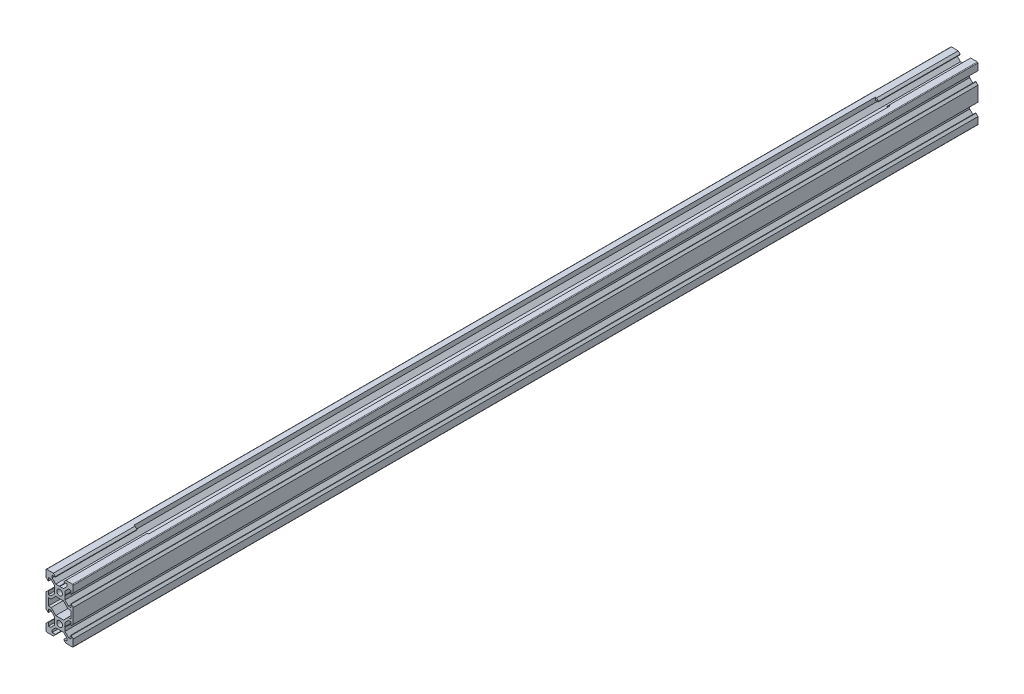
from build123d import *

# Parameters (mm, degrees)
SKETCH1_R           = 2.1
BOSS_EXTRUDE1_DEPTH = 332.5
SKETCH2_W           = 11
SKETCH2_H           = 1.8
CUT_EXTRUDE1_DEPTH  = 272.5


with BuildPart() as part:
    # Sketch1 → Boss-Extrude1 (new, symmetric)
    with BuildSketch(Plane.XY):
        with BuildLine():
            Line((4.58, -20), (9.5, -20))
            ThreePointArc((9.5, -20), (9.853553391, -19.853553391), (10, -19.5))
            Line((10, -19.5), (10, -14.58))
            Line((10, -14.58), (8.545, -13.125))
            Line((8.545, -13.125), (8.2, -13.125))
            Line((8.2, -13.125), (8.2, -15.5))
            Line((8.2, -15.5), (6.560660172, -15.5))
            Line((6.560660172, -15.5), (3.9, -12.839339828))
            Line((3.9, -12.839339828), (3.9, -10.21))
            Line((3.9, -10.21), (3.69, -10))
            Line((3.69, -10), (3.9, -9.79))
            Line((3.9, -9.79), (3.9, -7.160660172))
            Line((3.9, -7.160660172), (6.560660172, -4.5))
            Line((6.560660172, -4.5), (8.2, -4.5))
            Line((8.2, -4.5), (8.2, -6.875))
            Line((8.2, -6.875), (8.545, -6.875))
            Line((8.545, -6.875), (10, -5.42))
            Line((10, -5.42), (10, 5.42))
            Line((10, 5.42), (8.545, 6.875))
            Line((8.545, 6.875), (8.2, 6.875))
            Line((8.2, 6.875), (8.2, 4.5))
            Line((8.2, 4.5), (6.560660172, 4.5))
            Line((6.560660172, 4.5), (3.9, 7.160660172))
            Line((3.9, 7.160660172), (3.9, 9.79))
            Line((3.9, 9.79), (3.69, 10))
            Line((3.69, 10), (3.9, 10.21))
            Line((3.9, 10.21), (3.9, 12.839339828))
            Line((3.9, 12.839339828), (6.560660172, 15.5))
            Line((6.560660172, 15.5), (8.2, 15.5))
            Line((8.2, 15.5), (8.2, 13.125))
            Line((8.2, 13.125), (8.545, 13.125))
            Line((8.545, 13.125), (10, 14.58))
            Line((10, 14.58), (10, 19.5))
            ThreePointArc((10, 19.5), (9.853553391, 19.853553391), (9.5, 20))
            Line((9.5, 20), (4.58, 20))
            Line((4.58, 20), (3.125, 18.545))
            Line((3.125, 18.545), (3.125, 18.2))
            Line((3.125, 18.2), (5.5, 18.2))
            Line((5.5, 18.2), (5.5, 16.560660172))
            Line((5.5, 16.560660172), (2.839339828, 13.9))
            Line((2.839339828, 13.9), (0.21, 13.9))
            Line((0.21, 13.9), (0, 13.69))
            Line((0, 13.69), (-0.21, 13.9))
            Line((-0.21, 13.9), (-2.839339828, 13.9))
            Line((-2.839339828, 13.9), (-5.5, 16.560660172))
            Line((-5.5, 16.560660172), (-5.5, 18.2))
            Line((-5.5, 18.2), (-3.125, 18.2))
            Line((-3.125, 18.2), (-3.125, 18.545))
            Line((-3.125, 18.545), (-4.58, 20))
            Line((-4.58, 20), (-9.5, 20))
            ThreePointArc((-9.5, 20), (-9.853553391, 19.853553391), (-10, 19.5))
            Line((-10, 19.5), (-10, 14.58))
            Line((-10, 14.58), (-8.545, 13.125))
            Line((-8.545, 13.125), (-8.2, 13.125))
            Line((-8.2, 13.125), (-8.2, 15.5))
            Line((-8.2, 15.5), (-6.560660172, 15.5))
            Line((-6.560660172, 15.5), (-3.9, 12.839339828))
            Line((-3.9, 12.839339828), (-3.9, 10.21))
            Line((-3.9, 10.21), (-3.69, 10))
            Line((-3.69, 10), (-3.9, 9.79))
            Line((-3.9, 9.79), (-3.9, 7.160660172))
            Line((-3.9, 7.160660172), (-6.560660172, 4.5))
            Line((-6.560660172, 4.5), (-8.2, 4.5))
            Line((-8.2, 4.5), (-8.2, 6.875))
            Line((-8.2, 6.875), (-8.545, 6.875))
            Line((-8.545, 6.875), (-10, 5.42))
            Line((-10, 5.42), (-10, -5.42))
            Line((-10, -5.42), (-8.545, -6.875))
            Line((-8.545, -6.875), (-8.2, -6.875))
            Line((-8.2, -6.875), (-8.2, -4.5))
            Line((-8.2, -4.5), (-6.560660172, -4.5))
            Line((-6.560660172, -4.5), (-3.9, -7.160660172))
            Line((-3.9, -7.160660172), (-3.9, -9.79))
            Line((-3.9, -9.79), (-3.69, -10))
            Line((-3.69, -10), (-3.9, -10.21))
            Line((-3.9, -10.21), (-3.9, -12.839339828))
            Line((-3.9, -12.839339828), (-6.560660172, -15.5))
            Line((-6.560660172, -15.5), (-8.2, -15.5))
            Line((-8.2, -15.5), (-8.2, -13.125))
            Line((-8.2, -13.125), (-8.545, -13.125))
            Line((-8.545, -13.125), (-10, -14.58))
            Line((-10, -14.58), (-10, -19.5))
            ThreePointArc((-10, -19.5), (-9.853553391, -19.853553391), (-9.5, -20))
            Line((-9.5, -20), (-4.58, -20))
            Line((-4.58, -20), (-3.125, -18.545))
            Line((-3.125, -18.545), (-3.125, -18.2))
            Line((-3.125, -18.2), (-5.5, -18.2))
            Line((-5.5, -18.2), (-5.5, -16.560660172))
            Line((-5.5, -16.560660172), (-2.839339828, -13.9))
            Line((-2.839339828, -13.9), (-0.21, -13.9))
            Line((-0.21, -13.9), (0, -13.69))
            Line((0, -13.69), (0.21, -13.9))
            Line((0.21, -13.9), (2.839339828, -13.9))
            Line((2.839339828, -13.9), (5.5, -16.560660172))
            Line((5.5, -16.560660172), (5.5, -18.2))
            Line((5.5, -18.2), (3.125, -18.2))
            Line((3.125, -18.2), (3.125, -18.545))
            Line((3.125, -18.545), (4.58, -20))
        make_face()
        with Locations((0, -10)):
            Circle(SKETCH1_R, mode=Mode.SUBTRACT)
        Polygon((-6.239339828, -2.7), (-8.2, -2.7), (-8.2, 2.7), (-6.239339828, 2.7), (-2.839339828, 6.1), (2.839339828, 6.1), (6.239339828, 2.7), (8.2, 2.7), (8.2, -2.7), (6.239339828, -2.7), (2.839339828, -6.1), (-2.839339828, -6.1), align=None, mode=Mode.SUBTRACT)
        with Locations((0, 10)):
            Circle(SKETCH1_R, mode=Mode.SUBTRACT)
    extrude(amount=BOSS_EXTRUDE1_DEPTH, both=True)

    # Sketch2 → Cut-Extrude1 (cut, symmetric)
    with BuildSketch(Plane.XY):
        with Locations((0, -19.1)):
            Rectangle(SKETCH2_W, SKETCH2_H)
    cut_extrude1 = extrude(amount=CUT_EXTRUDE1_DEPTH, both=True, mode=Mode.SUBTRACT)

    # Mirror1: Cut-Extrude1 across plane
    add(cut_extrude1.mirror(Plane.ZX), mode=Mode.SUBTRACT)


solid = part.part
